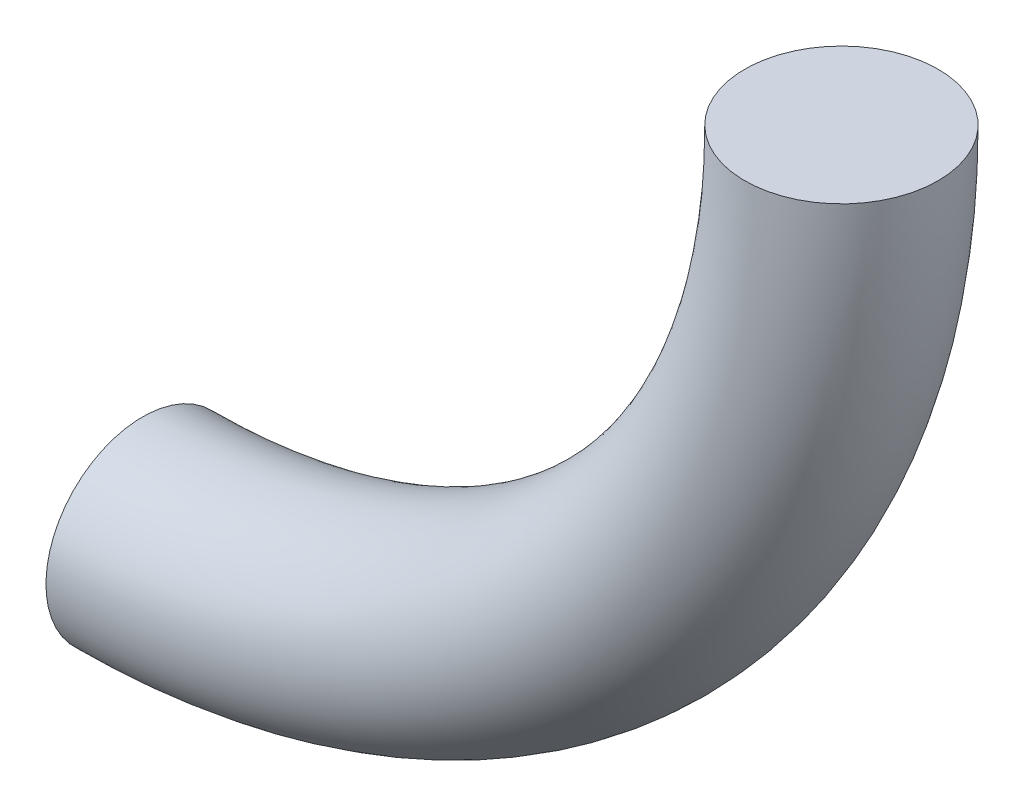
from build123d import *

# Parameters (mm, degrees)
SWEEPSECTION_R = 5.713


with BuildPart() as part:
    # OrdinarySweptBoss: sweep along a path in SweepPath
    with BuildLine(Plane.XY) as ordinarysweptboss_path:
        ThreePointArc((0, 0), (29.201388743, 12.095611257), (41.297, 41.297))
    # SweepSection → OrdinarySweptBoss (sweep)
    with BuildSketch(Plane(origin=(0, 0, 0), x_dir=(0, 0, -1), z_dir=(1, 0, 0))):
        Circle(SWEEPSECTION_R)
    sweep(path=ordinarysweptboss_path.line)


solid = part.part
